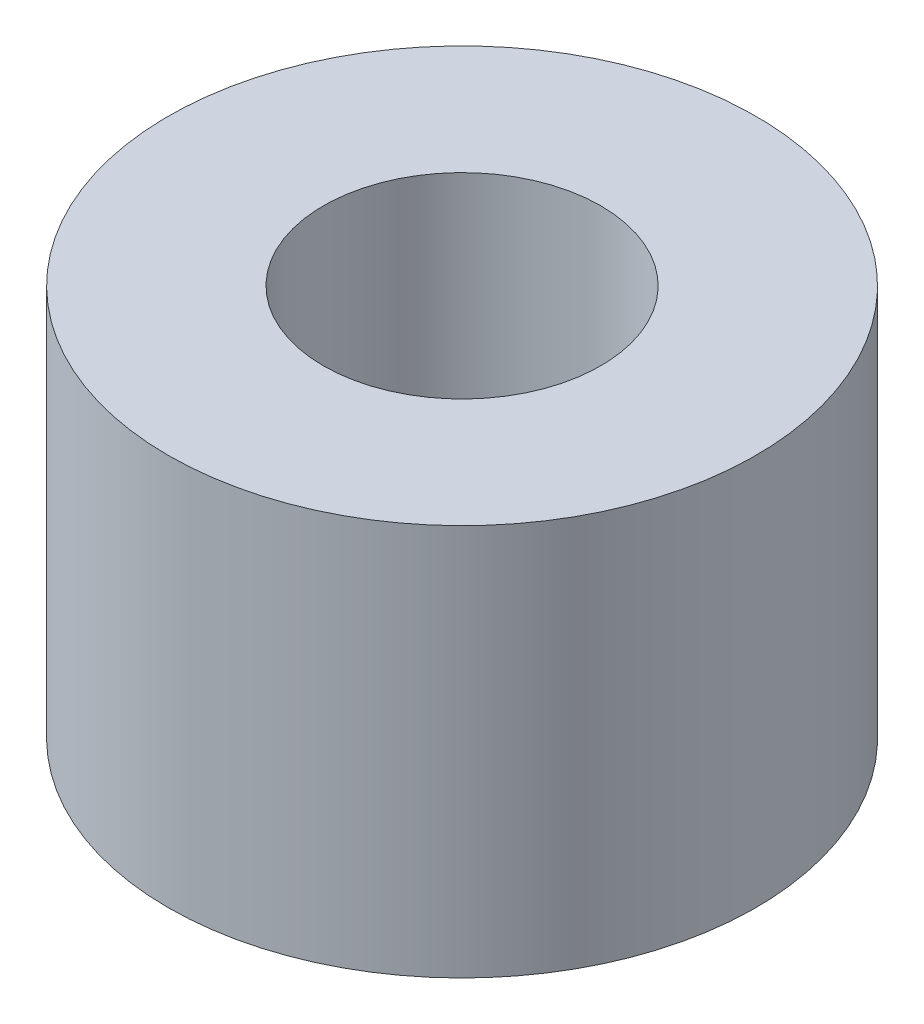
from build123d import *

# Parameters (mm, degrees)
SKETCH1_R           = 4.7625
SKETCH1_R_2         = 2.2479
BOSS_EXTRUDE1_DEPTH = 6.35


with BuildPart() as part:
    # Sketch1 → Boss-Extrude1 (new body)
    with BuildSketch(Plane(origin=(0, 0, 0), x_dir=(1, 0, 0), z_dir=(0, 1, 0))):
        with Locations(Location((0, 0, 0), (0, 0, 270))):
            Circle(SKETCH1_R)
        with Locations(Location((0, 0, 0), (0, 0, 270))):
            Circle(SKETCH1_R_2, mode=Mode.SUBTRACT)
    extrude(amount=BOSS_EXTRUDE1_DEPTH)


solid = part.part
